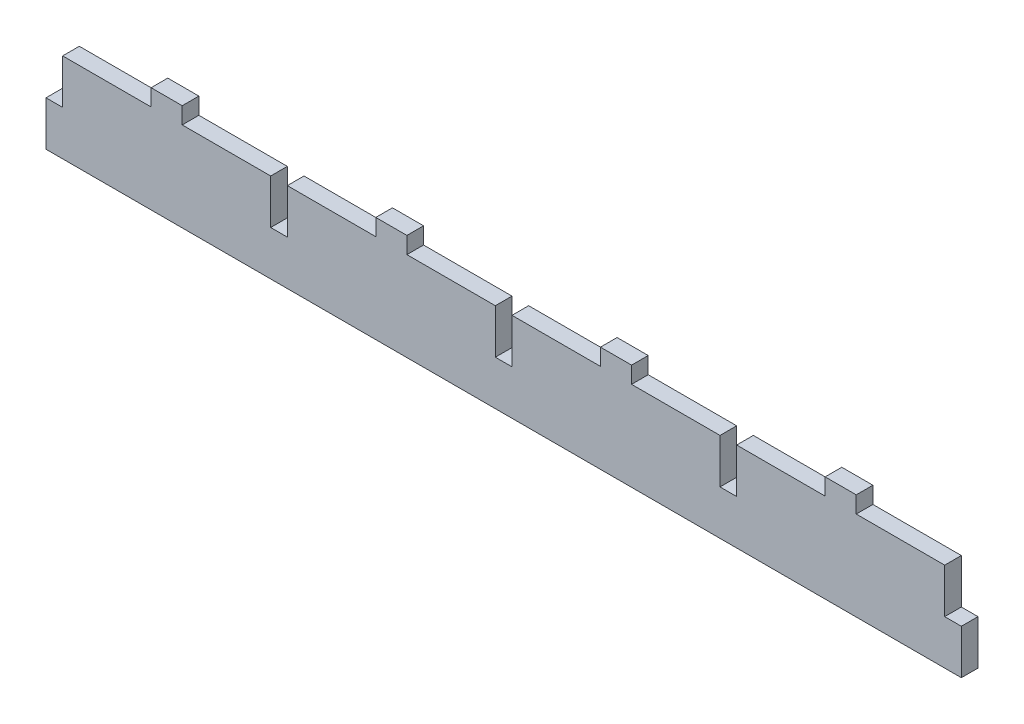
from build123d import *

# Parameters (mm, degrees)
BOSS_EXTRUDE1_DEPTH = 5.35


with BuildPart() as part:
    # Model → Boss-Extrude1 (new body)
    with BuildSketch(Plane.XY):
        Polygon((113.24375, 28.65), (141.65, 28.65), (141.65, 14.32), (147, 14.32), (147, 0), (-147, 0), (-147, 14.32), (-141.65, 14.32), (-141.65, 28.65), (-113.24375, 28.65), (-113.24375, 34), (-103.24375, 34), (-103.24375, 28.65), (-74.8375, 28.65), (-74.8375, 14.32), (-69.4875, 14.32), (-69.4875, 28.65), (-41.08125, 28.65), (-41.08125, 34), (-31.08125, 34), (-31.08125, 28.65), (-2.675, 28.65), (-2.675, 14.32), (2.675, 14.32), (2.675, 28.65), (31.08125, 28.65), (31.08125, 34), (41.08125, 34), (41.08125, 28.65), (69.4875, 28.65), (69.4875, 14.32), (74.8375, 14.32), (74.8375, 28.65), (103.24375, 28.65), (103.24375, 34), (113.24375, 34), align=None)
    extrude(amount=BOSS_EXTRUDE1_DEPTH)


solid = part.part
